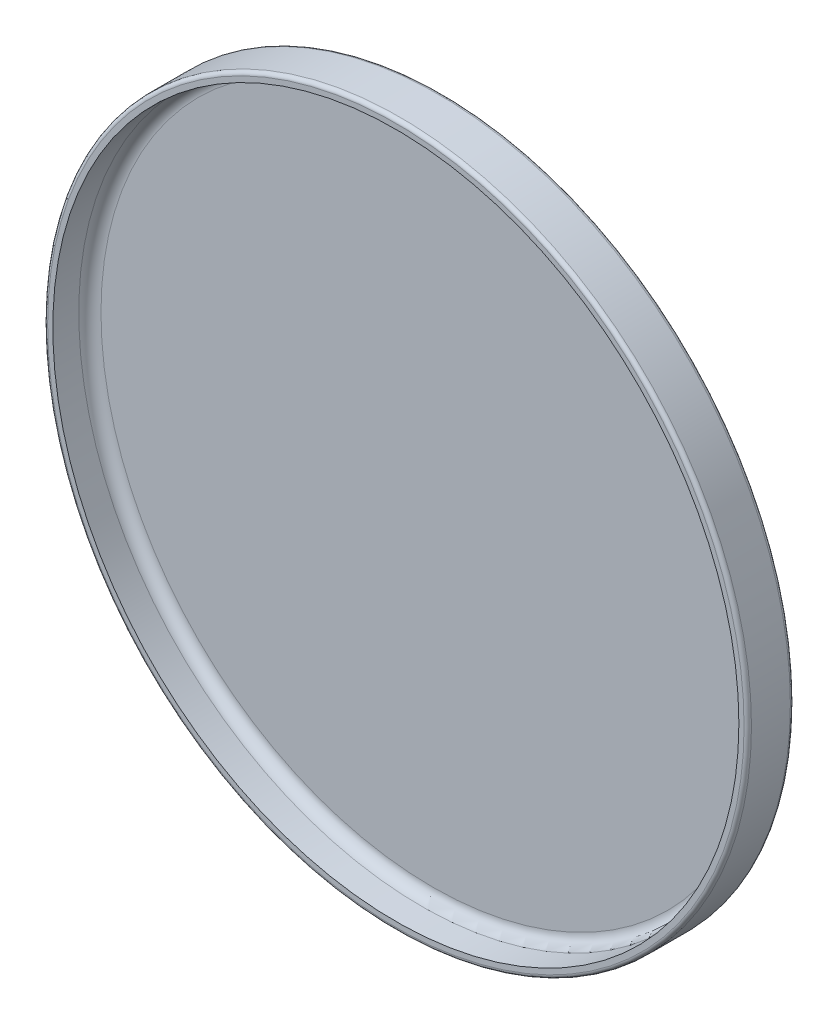
from build123d import *

# Parameters (mm, degrees)
SKETCH1_R           = 95
BOSS_EXTRUDE1_DEPTH = 2.5
BOSS_EXTRUDE2_START = 10
SKETCH1_3_R         = 95
SKETCH1_3_R_2       = 92.6
BOSS_EXTRUDE2_DEPTH = 10
FILLET3_R           = 1
FILLET4_R           = 1
FILLET5_R           = 3


with BuildPart() as part:
    # Sketch1 → Boss-Extrude1 (new body)
    with BuildSketch(Plane.XY):
        Circle(SKETCH1_R)
    extrude(amount=-BOSS_EXTRUDE1_DEPTH)

    # Sketch1<3> → Boss-Extrude2 (add)
    with BuildSketch(Plane.XY.offset(BOSS_EXTRUDE2_START)):
        Circle(SKETCH1_3_R)
        Circle(SKETCH1_3_R_2, mode=Mode.SUBTRACT)
    extrude(amount=-BOSS_EXTRUDE2_DEPTH)

    # Fillet3
    fillet3_edges = [part.edges().sort_by_distance(p)[0] for p in [
        (-95, 0, -2.5),
    ]]
    fillet(fillet3_edges, radius=FILLET3_R)

    # Fillet4
    fillet4_edges = [part.edges().sort_by_distance(p)[0] for p in [
        (-95, 0, 10),
    ]]
    fillet(fillet4_edges, radius=FILLET4_R)

    # Fillet5
    fillet5_edges = [part.edges().sort_by_distance(p)[0] for p in [
        (-92.6, 0, 0),
    ]]
    fillet(fillet5_edges, radius=FILLET5_R)


solid = part.part
